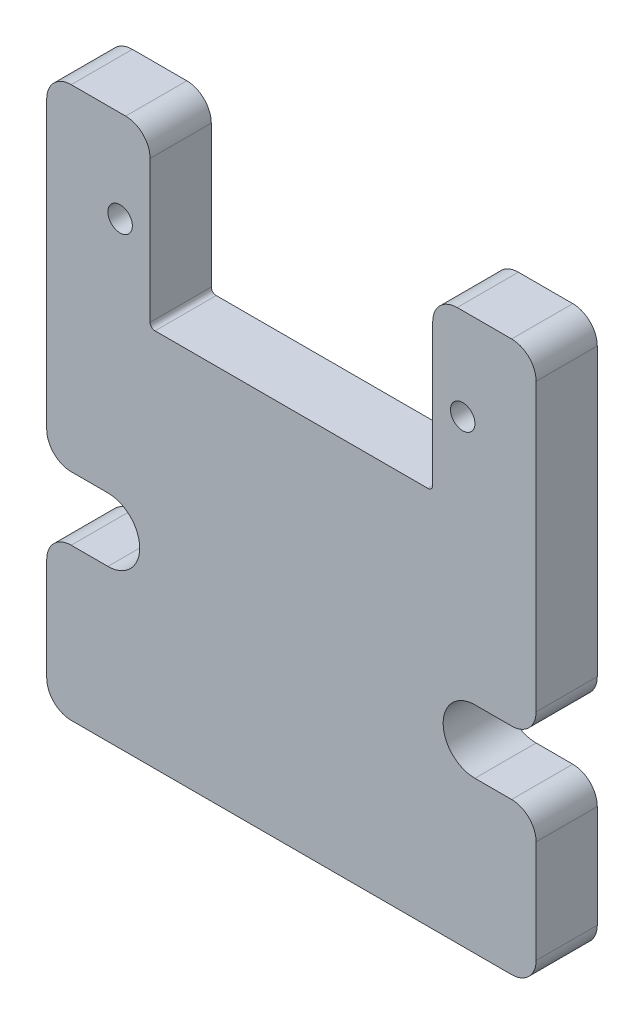
from build123d import *

# Parameters (mm, degrees)
ESQUISSE1_W             = 40
ESQUISSE1_H             = 60
ESQUISSE1_R             = 2.6
BOSS_EXTRU_1_DEPTH      = 5
ESQUISSE2_W             = 23.1
ESQUISSE2_H             = 14
ENL_V_MAT_EXTRU_1_DEPTH = 73.284161474
CONG_1_R                = 2
CONG_2_R                = 0.4
ESQUISSE3_R             = 1
ENL_V_MAT_EXTRU_2_DEPTH = 73.284161474
ESQUISSE4_W             = 48.028106485
ESQUISSE4_H             = 39.571936154
ENL_V_MAT_EXTRU_3_DEPTH = 10
CONG_3_R                = 2


with BuildPart() as part:
    # Esquisse1 → Boss.-Extru.1 (new body)
    with BuildSketch(Plane.XY):
        with Locations((20, 30)):
            Rectangle(ESQUISSE1_W, ESQUISSE1_H)
        with Locations((5, 30)):
            Circle(ESQUISSE1_R, mode=Mode.SUBTRACT)
        with Locations((35, 30)):
            Circle(ESQUISSE1_R, mode=Mode.SUBTRACT)
    extrude(amount=BOSS_EXTRU_1_DEPTH)

    # Esquisse2 → Enlèv. mat.-Extru.1 (cut, through all)
    with BuildSketch(Plane.XY.offset(5)):
        with BuildLine():
            Line((5, 27.4), (0, 27.4))
            ThreePointArc((0, 27.4), (-2.6, 30), (0, 32.6))
            Line((0, 32.6), (5, 32.6))
            ThreePointArc((5, 32.6), (7.6, 30), (5, 27.4))
        make_face()
        with BuildLine():
            Line((35, 32.6), (40, 32.6))
            ThreePointArc((40, 32.6), (42.6, 30), (40, 27.4))
            Line((40, 27.4), (35, 27.4))
            ThreePointArc((35, 27.4), (32.4, 30), (35, 32.6))
        make_face()
        with Locations((20, 53)):
            Rectangle(ESQUISSE2_W, ESQUISSE2_H)
        with Locations((20, 7)):
            Rectangle(ESQUISSE2_W, ESQUISSE2_H)
    extrude(amount=-ENL_V_MAT_EXTRU_1_DEPTH, mode=Mode.SUBTRACT)

    # Congé1
    cong_1_edges = [part.edges().sort_by_distance(p)[0] for p in [
        (0, 27.4, 2.5),
        (0, 32.6, 2.5),
        (40, 32.6, 2.5),
        (40, 27.4, 2.5),
        (8.45, 60, 2.5),
        (31.55, 60, 2.5),
        (8.45, 0, 2.5),
        (31.55, 0, 2.5),
        (0, 60, 2.5),
        (40, 60, 2.5),
        (40, 0, 2.5),
        (0, 0, 2.5),
    ]]
    fillet(cong_1_edges, radius=CONG_1_R)

    # Congé2
    cong_2_edges = [part.edges().sort_by_distance(p)[0] for p in [
        (8.45, 46, 2.5),
        (31.55, 46, 2.5),
        (8.45, 14, 2.5),
        (31.55, 14, 2.5),
    ]]
    fillet(cong_2_edges, radius=CONG_2_R)

    # Esquisse3 → Enlèv. mat.-Extru.2 (cut, through all)
    with BuildSketch(Plane.XY.offset(5)):
        with Locations((34, 52.5)):
            Circle(ESQUISSE3_R)
        with Locations((6, 52.5)):
            Circle(ESQUISSE3_R)
        with Locations(Location((6, 7.5, 0), (0, 0, 180))):
            Circle(ESQUISSE3_R)
        with Locations(Location((34, 7.5, 0), (0, 0, 180))):
            Circle(ESQUISSE3_R)
    extrude(amount=-ENL_V_MAT_EXTRU_2_DEPTH, mode=Mode.SUBTRACT)

    # Esquisse4 → Enlèv. mat.-Extru.3 (cut)
    with BuildSketch(Plane.XY.offset(5)):
        with Locations((15.985946757, -4.785968077)):
            Rectangle(ESQUISSE4_W, ESQUISSE4_H)
    extrude(amount=-ENL_V_MAT_EXTRU_3_DEPTH, mode=Mode.SUBTRACT)

    # Congé3
    cong_3_edges = [part.edges().sort_by_distance(p)[0] for p in [
        (0, 15, 2.5),
        (40, 15, 2.5),
    ]]
    fillet(cong_3_edges, radius=CONG_3_R)


solid = part.part
